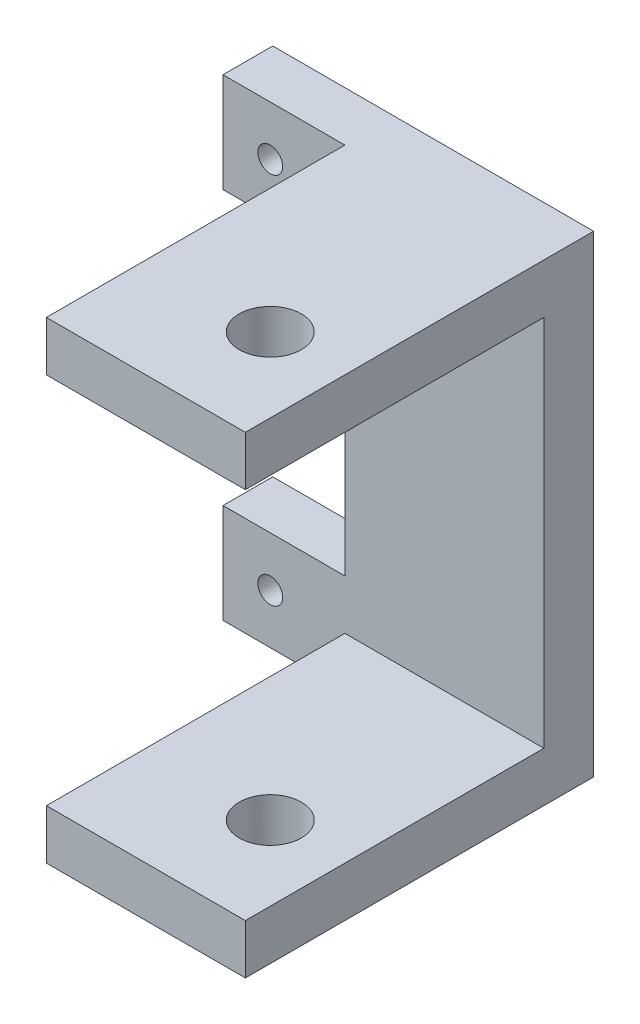
from build123d import *

# Parameters (mm, degrees)
EXTRUDE_1_DEPTH     = 2
SKETCH_3_W          = 8
SKETCH_3_H          = 2
EXTRUDE_2_DEPTH     = 12
SKETCH_11_R         = 1.25
CUT_EXTRUDE_3_DEPTH = 25.919871589
CUT_EXTRUDE_4_REACH = 19.27
SKETCH_10_R         = 0.5


with BuildPart() as part:
    # 草图2 → 凸台-拉伸1 (new body)
    with BuildSketch(Plane.XY):
        Polygon((-4.9, -9.5), (8, -9.5), (8, 9.5), (-4.9, 9.5), (-4.9, 5.5), (0, 5.5), (0, -5.5), (-4.9, -5.5), align=None)
    extrude(amount=EXTRUDE_1_DEPTH)

    # 草图3 → 凸台-拉伸2 (add)
    with BuildSketch(Plane.XY.offset(2)):
        with Locations((4, 8.5)):
            Rectangle(SKETCH_3_W, SKETCH_3_H)
        with Locations((4, -8.5)):
            Rectangle(SKETCH_3_W, SKETCH_3_H)
    extrude(amount=EXTRUDE_2_DEPTH)

    # 草图11 → 切除-拉伸3 (cut, through all)
    with BuildSketch(Plane.XZ.offset(9.5)):
        with Locations(Location((5, 10, 0), (0, 0, 270))):
            Circle(SKETCH_11_R)
    extrude(amount=-CUT_EXTRUDE_3_DEPTH, mode=Mode.SUBTRACT)

    # 草图10 → 切除-拉伸4 (cut, up to next)
    with BuildSketch(Plane.XY.offset(2), mode=Mode.PRIVATE) as cut_extrude_4_sk1:
        with Locations((-3, 7.5)):
            Circle(SKETCH_10_R)
    cut_extrude_4_tool1 = extrude(cut_extrude_4_sk1.sketch, amount=-CUT_EXTRUDE_4_REACH, mode=Mode.PRIVATE) & part.part
    # 草图10 → 切除-拉伸4 (cut, up to next)
    with BuildSketch(Plane.XY.offset(2), mode=Mode.PRIVATE) as cut_extrude_4_sk2:
        with Locations((-3, -7.5)):
            Circle(SKETCH_10_R)
    cut_extrude_4_tool2 = extrude(cut_extrude_4_sk2.sketch, amount=-CUT_EXTRUDE_4_REACH, mode=Mode.PRIVATE) & part.part
    add(cut_extrude_4_tool1.solids().sort_by_distance((-3, 7.5, 2))[0], mode=Mode.SUBTRACT)
    add(cut_extrude_4_tool2.solids().sort_by_distance((-3, -7.5, 2))[0], mode=Mode.SUBTRACT)


solid = part.part
